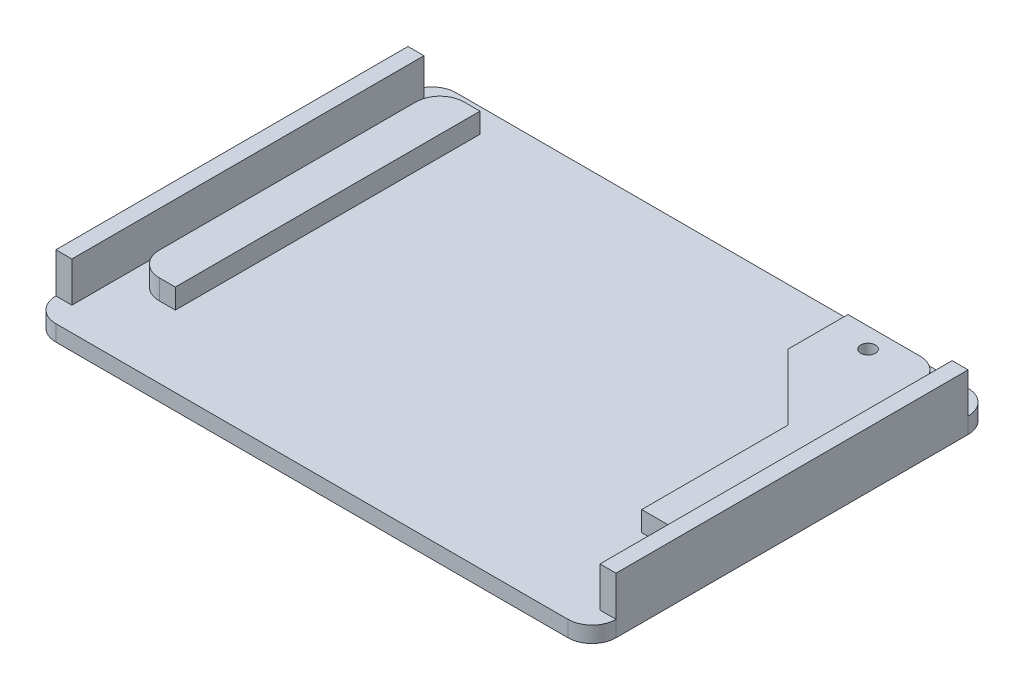
from build123d import *

# Parameters (mm, degrees)
SKETCH_1_W      = 70
SKETCH_1_H      = 50
EXTRUDE_1_DEPTH = 2
FILLET_1_R      = 3
SKETCH_2_W      = 2
SKETCH_2_H      = 44
EXTRUDE_2_DEPTH = 5
SKETCH_3_R      = 0.91
EXTRUDE_3_DEPTH = 2.5


with BuildPart() as part:
    # 草图1 → 凸台-拉伸1 (new body)
    with BuildSketch(Plane(origin=(0, 0, 0), x_dir=(1, 0, 0), z_dir=(0, 1, 0))):
        Rectangle(SKETCH_1_W, SKETCH_1_H)
    extrude(amount=EXTRUDE_1_DEPTH)

    # 圆角1
    fillet_1_edges = [part.edges().sort_by_distance(p)[0] for p in [
        (35, 1, 25),
        (-35, 1, 25),
        (-35, 1, -25),
        (35, 1, -25),
    ]]
    fillet(fillet_1_edges, radius=FILLET_1_R)

    # 草图2 → 凸台-拉伸2 (add)
    with BuildSketch(Plane(origin=(0, 2, 0), x_dir=(1, 0, 0), z_dir=(0, 1, 0))):
        with Locations((-34, 0)):
            Rectangle(SKETCH_2_W, SKETCH_2_H)
        with Locations((34, 0)):
            Rectangle(SKETCH_2_W, SKETCH_2_H)
    extrude(amount=EXTRUDE_2_DEPTH)

    # 草图3 → 凸台-拉伸3 (add)
    # profile 1 of 2: a face of its own
    with BuildSketch(Plane(origin=(0, 2, 0), x_dir=(1, 0, 0), z_dir=(0, 1, 0))):
        with BuildLine():
            Line((28, 22.985971126), (19, 22.985971126))
            Line((19, 22.985971126), (19, 15.46603773))
            Line((19, 15.46603773), (27.222114772, 7.243922958))
            Line((27.222114772, 7.243922958), (27.222114772, -11.014028874))
            Line((27.222114772, -11.014028874), (31, -11.014028874))
            Line((31, -11.014028874), (31, 19.985971126))
            ThreePointArc((31, 19.985971126), (30.121320344, 22.10729147), (28, 22.985971126))
        make_face()
        with Locations(Location((24, 20.49257992, 0), (0, 0, 270))):
            Circle(SKETCH_3_R, mode=Mode.SUBTRACT)
    # profile 2 of 2: a face of its own
    with BuildSketch(Plane(origin=(0, 2, 0), x_dir=(1, 0, 0), z_dir=(0, 1, 0))):
        with BuildLine():
            Line((-28, 22), (-26, 22))
            Line((-26, 22), (-26, -16.071759555))
            Line((-26, -16.071759555), (-28, -16.071759555))
            ThreePointArc((-28, -16.071759555), (-30.121320344, -15.193079899), (-31, -13.071759555))
            Line((-31, -13.071759555), (-31, 19))
            ThreePointArc((-31, 19), (-30.121320344, 21.121320344), (-28, 22))
        make_face()
    extrude(amount=EXTRUDE_3_DEPTH)


solid = part.part
